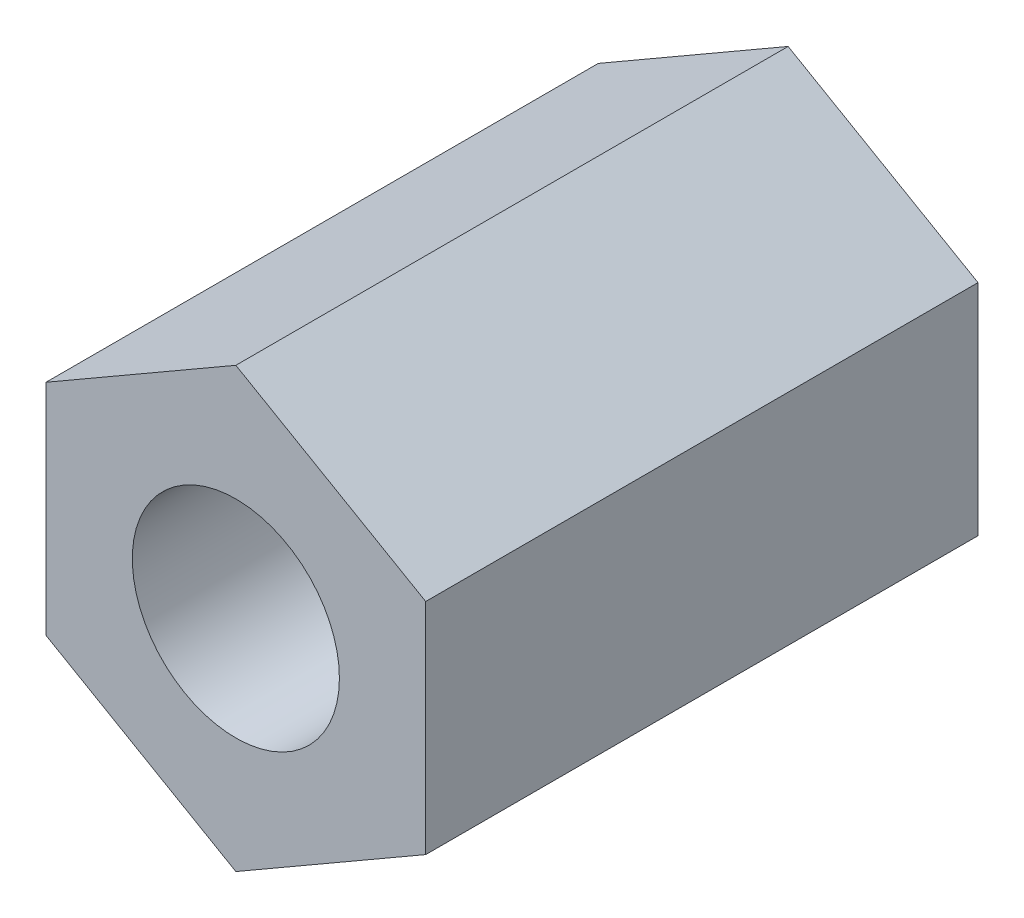
from build123d import *

# Parameters (mm, degrees)
ESQUISSE1_R        = 1.5
BOSS_EXTRU_1_DEPTH = 8


with BuildPart() as part:
    # Esquisse1 → Boss.-Extru.1 (new body)
    with BuildSketch(Plane.XY):
        Polygon((0, -3.175426481), (2.75, -1.58771324), (2.75, 1.58771324), (0, 3.175426481), (-2.75, 1.58771324), (-2.75, -1.58771324), align=None)
        Circle(ESQUISSE1_R, mode=Mode.SUBTRACT)
    extrude(amount=BOSS_EXTRU_1_DEPTH)


solid = part.part
